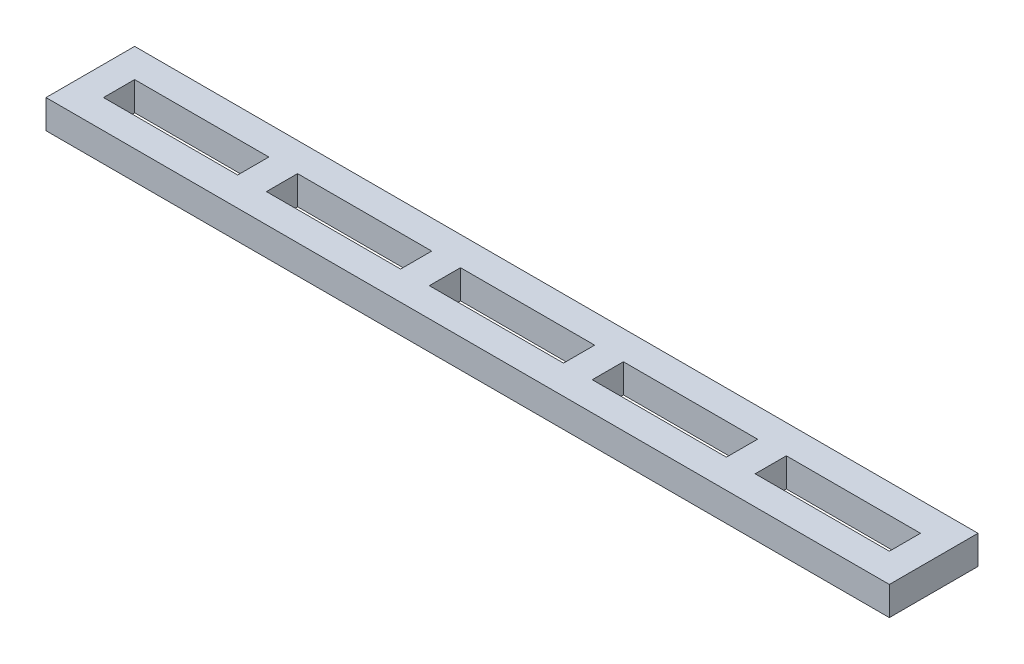
from build123d import *

# Parameters (mm, degrees)
SKETCH1_W           = 58.7375
SKETCH1_H           = 19.05
BOSS_EXTRUDE1_DEPTH = 279.4
SKETCH2_W           = 88.9
SKETCH2_H           = 20.6375
CUT_EXTRUDE1_DEPTH  = 282.584420692


with BuildPart() as part:
    # Sketch1 → Boss-Extrude1 (new, symmetric)
    with BuildSketch(Plane(origin=(0, 0, 0), x_dir=(0, 0, -1), z_dir=(1, 0, 0))):
        Rectangle(SKETCH1_W, SKETCH1_H)
    extrude(amount=BOSS_EXTRUDE1_DEPTH, both=True)

    # Sketch2 → Cut-Extrude1 (cut, through all)
    with BuildSketch(Plane(origin=(0, 9.525, 0), x_dir=(1, 0, 0), z_dir=(0, 1, 0))):
        with Locations((-215.9, 0)):
            Rectangle(SKETCH2_W, SKETCH2_H)
        with Locations((215.9, 0)):
            Rectangle(SKETCH2_W, SKETCH2_H)
        with Locations((-107.95, 0)):
            Rectangle(SKETCH2_W, SKETCH2_H)
        Rectangle(SKETCH2_W, SKETCH2_H)
        with Locations((107.95, 0)):
            Rectangle(SKETCH2_W, SKETCH2_H)
    extrude(amount=-CUT_EXTRUDE1_DEPTH, mode=Mode.SUBTRACT)


solid = part.part
